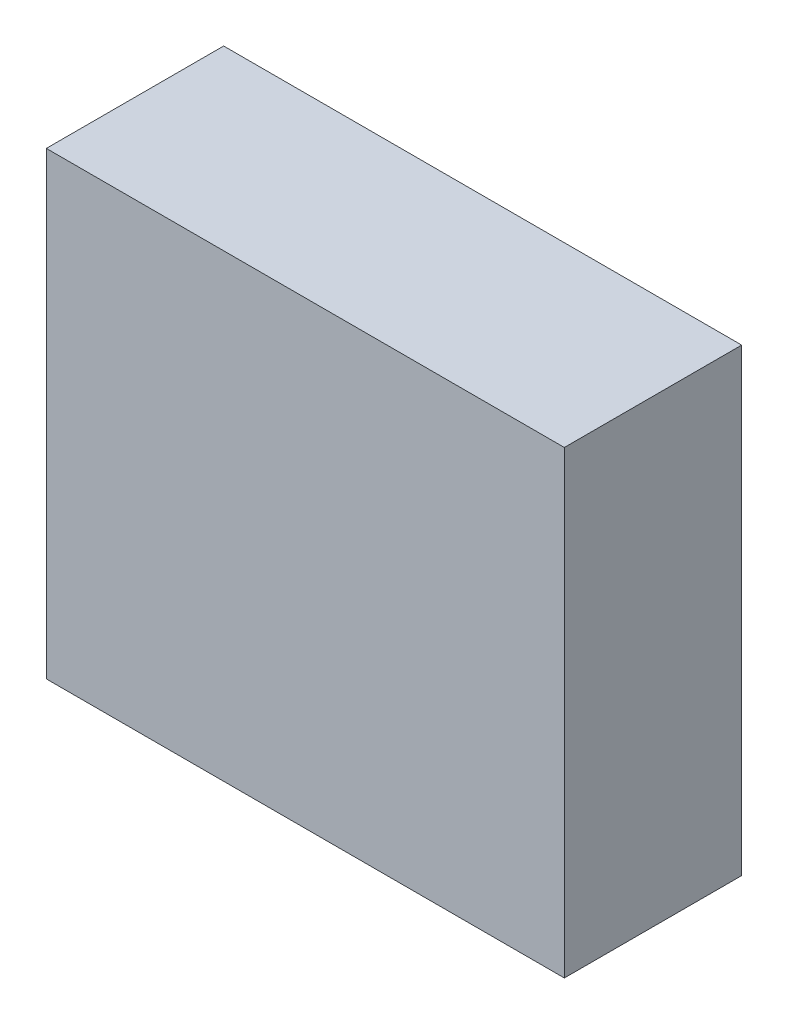
from build123d import *

# Parameters (mm, degrees)
SKETCH1_W               = 2.921
SKETCH1_H               = 2.5908
COMPONENT_OUTLINE_DEPTH = 1


with BuildPart() as part:
    # Sketch1 → Component_Outline (new body)
    with BuildSketch(Plane.XY):
        with Locations((0.0381, 0)):
            Rectangle(SKETCH1_W, SKETCH1_H)
    extrude(amount=COMPONENT_OUTLINE_DEPTH)


solid = part.part
